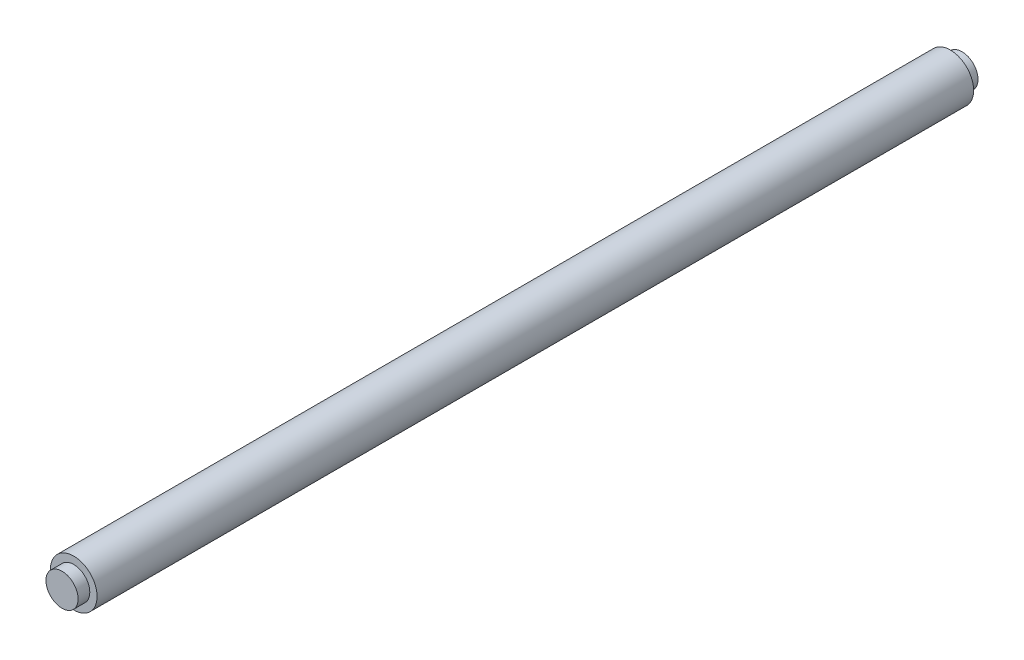
from build123d import *

# Parameters (mm, degrees)
CROQUIS1_R              = 2
SALIENTE_EXTRUIR1_DEPTH = 75
CROQUIS2_R              = 1.375
SALIENTE_EXTRUIR2_DEPTH = 1
SALIENTE_EXTRUIR3_START = 1
CROQUIS4_R              = 1.375
SALIENTE_EXTRUIR3_DEPTH = 1


with BuildPart() as part:
    # Croquis1 → Saliente-Extruir1 (new body)
    with BuildSketch(Plane.XY):
        Circle(CROQUIS1_R)
    extrude(amount=SALIENTE_EXTRUIR1_DEPTH)

    # Croquis2 → Saliente-Extruir2 (add)
    with BuildSketch(Plane.XY.offset(75)):
        Circle(CROQUIS2_R)
    extrude(amount=SALIENTE_EXTRUIR2_DEPTH)

    # Croquis4 → Saliente-Extruir3 (add)
    with BuildSketch(Plane(origin=(0, 0, 0), x_dir=(-1, 0, 0), z_dir=(0, 0, -1)).offset(SALIENTE_EXTRUIR3_START)):
        with Locations(Location((0, 0, 0), (0, 0, 180))):
            Circle(CROQUIS4_R)
    extrude(amount=-SALIENTE_EXTRUIR3_DEPTH)


solid = part.part
